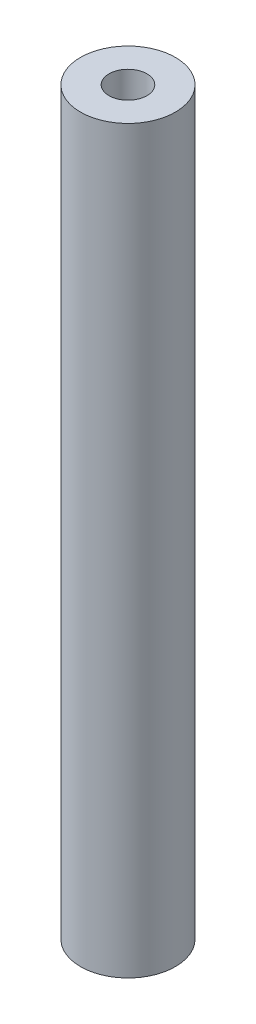
from build123d import *

# Parameters (mm, degrees)
SKETCH1_R           = 2.5
SKETCH1_R_2         = 1
BOSS_EXTRUDE1_DEPTH = 39


with BuildPart() as part:
    # Sketch1 → Boss-Extrude1 (new body)
    with BuildSketch(Plane(origin=(0, 0, 0), x_dir=(1, 0, 0), z_dir=(0, 1, 0))):
        with Locations(Location((0, 0, 0), (0, 0, 270))):
            Circle(SKETCH1_R)
        with Locations(Location((0, 0, 0), (0, 0, 270))):
            Circle(SKETCH1_R_2, mode=Mode.SUBTRACT)
    extrude(amount=BOSS_EXTRUDE1_DEPTH)


solid = part.part
